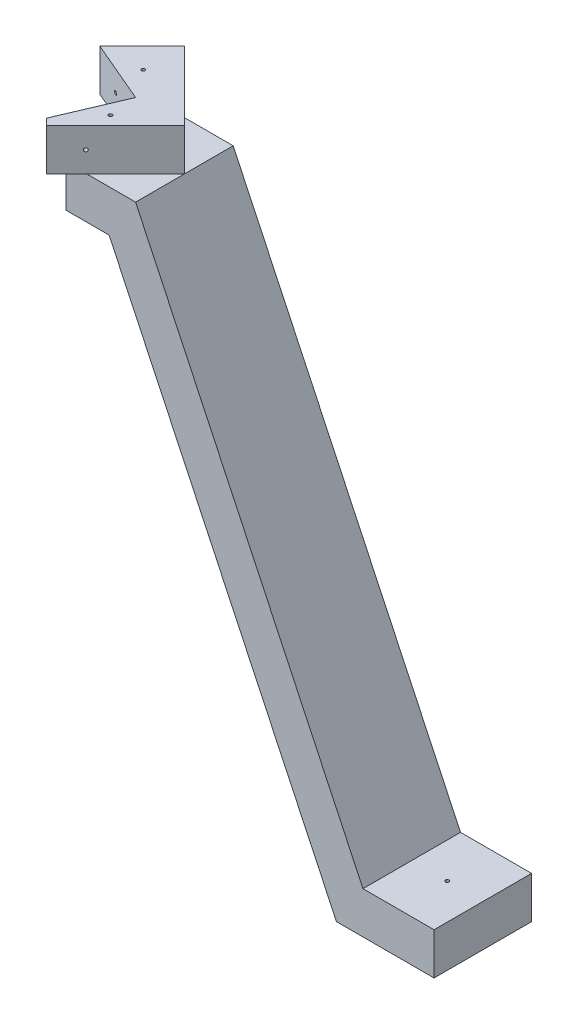
from build123d import *

# Parameters (mm, degrees)
BOSS_EXTRUDE1_DEPTH          = 44.45
F_1_8_0_125_DIAMETER_HOLE1_D = 3.175
BOSS_EXTRUDE2_DEPTH          = 38.1
CUT_EXTRUDE1_DEPTH           = 540.678885891
CUT_EXTRUDE1_DEPTH_BACK      = 540.678885891
F_1_8_0_125_DIAMETER_HOLE2_D = 3.175
F_1_8_0_125_DIAMETER_HOLE3_D = 3.175
F_1_8_0_125_DIAMETER_HOLE4_D = 3.175


with BuildPart() as part:
    # Sketch1 → Boss-Extrude1 (new, symmetric)
    with BuildSketch(Plane.XY):
        Polygon((0, 0), (-207.156155531, 438.15), (-271.925944469, 438.15), (-271.925944469, 476.25), (-183.025944469, 476.25), (24.130211063, 38.1), (88.9, 38.1), (88.9, 0), align=None)
    extrude(amount=BOSS_EXTRUDE1_DEPTH, both=True)

    # 1/8 (0.125) Diameter Hole1 (through all)
    with Locations(Plane(origin=(56.515105531, 38.1, 0), x_dir=(0, 0, 1), z_dir=(0, 1, 0))):
        with Locations((0, 0)):
            Hole(F_1_8_0_125_DIAMETER_HOLE1_D / 2)

    # Sketch4 → Boss-Extrude2 (add)
    with BuildSketch(Plane(origin=(0, 476.25, 0), x_dir=(1, 0, 0), z_dir=(0, 1, 0))):
        Polygon((-245.887737316, 62.861792847), (-183.025944469, 0), (-245.887737316, -62.861792847), (-308.749530164, 0), align=None)
    extrude(amount=BOSS_EXTRUDE2_DEPTH)

    # Sketch6 → Cut-Extrude1 (cut, two sides: drawn at the far end of the back side and taken through both)
    with BuildSketch(Plane.XZ.offset(-438.15).offset(-CUT_EXTRUDE1_DEPTH_BACK)):
        Polygon((-308.749530164, 190.368300991), (-227.475944469, 0), (-308.749530164, -34.697981215), align=None)
    extrude(amount=CUT_EXTRUDE1_DEPTH + CUT_EXTRUDE1_DEPTH_BACK, mode=Mode.SUBTRACT)

    # 1/8 (0.125) Diameter Hole2 (through all)
    with Locations(Plane(origin=(-91.512972234, 0, -91.512972234), x_dir=(0.707106781186549, 0, -0.707106781186546), z_dir=(0.707106781186546, 0, 0.707106781186549))):
        with Locations((-192.918886467, 495.3)):
            Hole(F_1_8_0_125_DIAMETER_HOLE2_D / 2)

    # 1/8 (0.125) Diameter Hole3 (through all)
    with Locations(Plane(origin=(-91.512972234, 0, 91.512972234), x_dir=(-0.707106781186549, 0, -0.707106781186546), z_dir=(0.707106781186546, 0, -0.707106781186549))):
        with Locations((192.918886467, 495.3)):
            Hole(F_1_8_0_125_DIAMETER_HOLE3_D / 2)

    # 1/8 (0.125) Diameter Hole4 (through all)
    with Locations(Plane(origin=(0, 438.15, 0), x_dir=(-1, 0, 0), z_dir=(0, -1, 0))):
        with Locations((224.936155531, -25.4), (245.887737316, 25.4)):
            Hole(F_1_8_0_125_DIAMETER_HOLE4_D / 2)


solid = part.part
